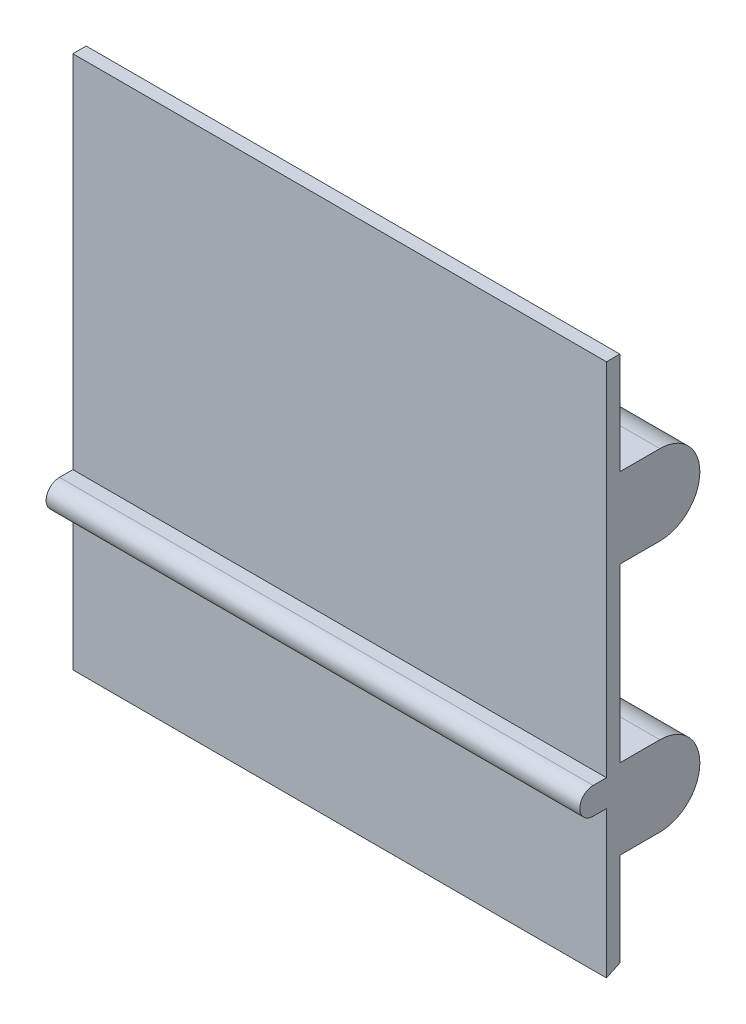
from build123d import *

# Parameters (mm, degrees)
SKETCH1_W           = 127
SKETCH1_H           = 127
BOSS_EXTRUDE1_DEPTH = 3.175
CUT_EXTRUDE1_DEPTH  = 143.025809714
BOSS_EXTRUDE3_DEPTH = 127
BOSS_EXTRUDE4_DEPTH = 127


with BuildPart() as part:
    # Sketch1 → Boss-Extrude1 (new body)
    with BuildSketch(Plane.XY):
        Rectangle(SKETCH1_W, SKETCH1_H)
    extrude(amount=BOSS_EXTRUDE1_DEPTH)

    # Sketch2 → Cut-Extrude1 (cut, through all)
    with BuildSketch(Plane(origin=(63.5, 0, 0), x_dir=(0, 0, -1), z_dir=(1, 0, 0))):
        Polygon((-3.175, -63.5), (0, -62.019473185), (0, -63.5), align=None)
    extrude(amount=-CUT_EXTRUDE1_DEPTH, mode=Mode.SUBTRACT)

    # Sketch3 → Boss-Extrude3 (add)
    with BuildSketch(Plane(origin=(63.5, 0, 0), x_dir=(0, 0, -1), z_dir=(1, 0, 0))):
        with BuildLine():
            Line((9.525, 39.255526815), (0, 39.255526815))
            Line((0, 39.255526815), (0, 20.205526815))
            Line((0, 20.205526815), (9.525, 20.205526815))
            ThreePointArc((9.525, 20.205526815), (19.05, 29.730526815), (9.525, 39.255526815))
        make_face()
        with BuildLine():
            Line((9.525, -20.744473185), (0, -20.744473185))
            Line((0, -20.744473185), (0, -39.794473185))
            Line((0, -39.794473185), (9.525, -39.794473185))
            ThreePointArc((9.525, -39.794473185), (19.05, -30.269473185), (9.525, -20.744473185))
        make_face()
    extrude(amount=-BOSS_EXTRUDE3_DEPTH)

    # Sketch4 → Boss-Extrude4 (add)
    with BuildSketch(Plane(origin=(63.5, 0, 0), x_dir=(0, 0, -1), z_dir=(1, 0, 0))):
        with BuildLine():
            Line((-6.35, -22.225), (-3.175, -22.225))
            Line((-3.175, -22.225), (-3.175, -28.575))
            Line((-3.175, -28.575), (-6.35, -28.575))
            ThreePointArc((-6.35, -28.575), (-9.525, -25.4), (-6.35, -22.225))
        make_face()
    extrude(amount=-BOSS_EXTRUDE4_DEPTH)


solid = part.part
